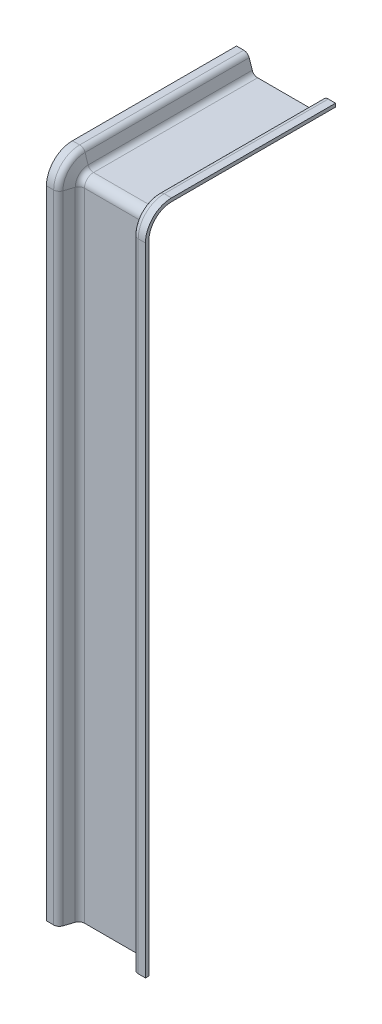
from build123d import *

# Parameters (mm, degrees)
RIB_3_REACH     = 244.396
SKETCH_3_WALL_W = 515.076556858
SKETCH_3_WALL_H = 2


with BuildPart() as part:
    # 扫描1: sweep along a path in 草图2
    with BuildLine(Plane(origin=(0, 0, 0), x_dir=(0, 0, -1), z_dir=(1, 0, 0))) as sweep_1_path:
        Line((0, 0), (0, 225))
        ThreePointArc((0, 225), (0.585786438, 226.414213562), (2, 227))
        Line((2, 227), (60, 227))
    # 草图1 → 扫描1 (sweep)
    with BuildSketch(Plane(origin=(0, 0, 0), x_dir=(1, 0, 0), z_dir=(0, 1, 0))):
        with BuildLine():
            Line((17.5, -7.2), (14.94151844, -7.2))
            ThreePointArc((14.94151844, -7.2), (13.772097871, -6.82248437), (13.044151844, -5.832455532))
            Line((13.044151844, -5.832455532), (11.955848156, -2.567544468))
            ThreePointArc((11.955848156, -2.567544468), (11.227902129, -1.57751563), (10.05848156, -1.2))
            Line((10.05848156, -1.2), (-10.05848156, -1.2))
            ThreePointArc((-10.05848156, -1.2), (-11.227902129, -1.57751563), (-11.955848156, -2.567544468))
            Line((-11.955848156, -2.567544468), (-13.044151844, -5.832455532))
            ThreePointArc((-13.044151844, -5.832455532), (-13.772097871, -6.82248437), (-14.94151844, -7.2))
            Line((-14.94151844, -7.2), (-17.5, -7.2))
            Line((-17.5, -7.2), (-17.5, -6))
            Line((-17.5, -6), (-14.94151844, -6))
            ThreePointArc((-14.94151844, -6), (-14.473750212, -5.848993748), (-14.182571802, -5.452982213))
            Line((-14.182571802, -5.452982213), (-13.094268114, -2.188071149))
            ThreePointArc((-13.094268114, -2.188071149), (-11.929554471, -0.604025007), (-10.05848156, 0))
            Line((-10.05848156, 0), (10.05848156, 0))
            ThreePointArc((10.05848156, 0), (11.929554471, -0.604025007), (13.094268114, -2.188071149))
            Line((13.094268114, -2.188071149), (14.182571802, -5.452982213))
            ThreePointArc((14.182571802, -5.452982213), (14.473750212, -5.848993748), (14.94151844, -6))
            Line((14.94151844, -6), (17.5, -6))
            Line((17.5, -6), (17.5, -7.2))
        make_face()
    sweep(path=sweep_1_path.line)

    # 草图3 wall → 筋3 (add, up to next)
    with BuildSketch(Plane(origin=(0, 217, -10), x_dir=(0, 0.707106781187, -0.707106781187), z_dir=(0, 0.707106781187, 0.707106781187)), mode=Mode.PRIVATE) as rib_3_sk1:
        Rectangle(SKETCH_3_WALL_W, SKETCH_3_WALL_H)
    rib_3_tool1 = extrude(rib_3_sk1.sketch, amount=RIB_3_REACH, mode=Mode.PRIVATE) - part.part
    add(rib_3_tool1.solids().sort_by_distance((0, 217, -10))[0])


solid = part.part
